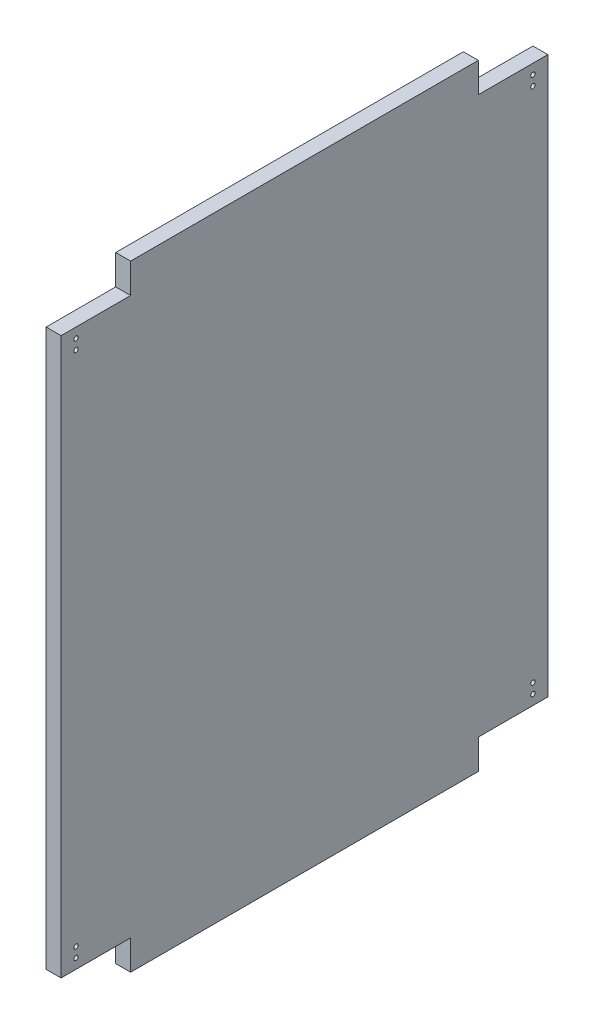
from build123d import *

# Parameters (mm, degrees)
SKETCH1_W              = 622.3
SKETCH1_H              = 787.4
BOSS_EXTRUDE1_DEPTH    = 19.05
SKETCH2_W              = 88.9
SKETCH2_H              = 38.1
CUT_EXTRUDE1_DEPTH     = 1004.802247706
F_10_CLEARANCE_HOLE6_D = 5.6134


with BuildPart() as part:
    # Sketch1 → Boss-Extrude1 (new body)
    with BuildSketch(Plane(origin=(0, 0, 0), x_dir=(0, 0, -1), z_dir=(1, 0, 0))):
        with Locations((-311.15, 393.7)):
            Rectangle(SKETCH1_W, SKETCH1_H)
    extrude(amount=-BOSS_EXTRUDE1_DEPTH)

    # Sketch2 → Cut-Extrude1 (cut, through all)
    with BuildSketch(Plane.ZY.offset(19.05)):
        with Locations((44.45, 768.35)):
            Rectangle(SKETCH2_W, SKETCH2_H)
        with Locations((577.85, 768.35)):
            Rectangle(SKETCH2_W, SKETCH2_H)
        with Locations((577.85, 19.05)):
            Rectangle(SKETCH2_W, SKETCH2_H)
        with Locations((44.45, 19.05)):
            Rectangle(SKETCH2_W, SKETCH2_H)
    extrude(amount=-CUT_EXTRUDE1_DEPTH, mode=Mode.SUBTRACT)

    # #10 Clearance Hole6 (through all)
    with Locations(Plane(origin=(0, 0, 0), x_dir=(0, 0, -1), z_dir=(1, 0, 0))):
        with Locations((-603.25, 50.8), (-603.25, 63.5), (-19.05, 50.8), (-19.05, 63.5), (-19.05, 723.9), (-19.05, 736.6), (-603.25, 723.9), (-603.25, 736.6)):
            Hole(F_10_CLEARANCE_HOLE6_D / 2)


solid = part.part
